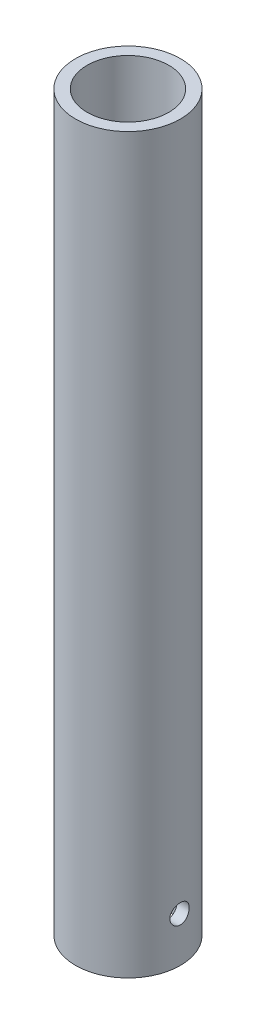
from build123d import *

# Parameters (mm, degrees)
SKETCH1_R               = 10.85
SKETCH1_R_2             = 8.45
BOSS_EXTRUDE1_DEPTH     = 151.72
SKETCH3_R               = 2
CUT_EXTRUDE2_DEPTH      = 153.493945454
CUT_EXTRUDE3_DEPTH      = 153.493945567
CUT_EXTRUDE3_DEPTH_BACK = 153.493945567
SKETCH4_R               = 2


with BuildPart() as part:
    # Sketch1 → Boss-Extrude1 (new body)
    with BuildSketch(Plane(origin=(0, 0, 0), x_dir=(1, 0, 0), z_dir=(0, 1, 0))):
        with Locations(Location((0, 0, 0), (0, 0, 270))):
            Circle(SKETCH1_R)
        with Locations(Location((0, 0, 0), (0, 0, 270))):
            Circle(SKETCH1_R_2, mode=Mode.SUBTRACT)
    extrude(amount=BOSS_EXTRUDE1_DEPTH)

    # Sketch3 → Cut-Extrude2 (cut, through all)
    with BuildSketch(Plane.XY):
        with Locations(Location((0, 9.28, 0), (0, 0, 90))):
            Circle(SKETCH3_R)
    extrude(amount=-CUT_EXTRUDE2_DEPTH, mode=Mode.SUBTRACT)

    # Sketch4 → Cut-Extrude3 (cut, two sides: drawn at the far end of the back side and taken through both)
    with BuildSketch(Plane(origin=(0, 0, 0), x_dir=(0, 0, -1), z_dir=(1, 0, 0)).offset(-CUT_EXTRUDE3_DEPTH_BACK)):
        with Locations((0, 9.28)):
            Circle(SKETCH4_R)
    extrude(amount=CUT_EXTRUDE3_DEPTH + CUT_EXTRUDE3_DEPTH_BACK, mode=Mode.SUBTRACT)


solid = part.part
